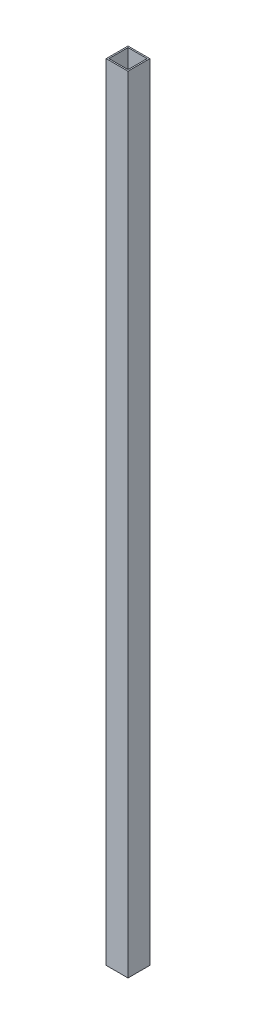
from build123d import *

# Parameters (mm, degrees)
SKETCH1_W           = 25.4
SKETCH1_H           = 25.4
SKETCH1_W_2         = 22.225
SKETCH1_H_2         = 22.225
BOSS_EXTRUDE1_DEPTH = 914.4


with BuildPart() as part:
    # Sketch1 → Boss-Extrude1 (new body)
    with BuildSketch(Plane(origin=(0, 0, 0), x_dir=(1, 0, 0), z_dir=(0, 1, 0))):
        with Locations((12.7, 12.7)):
            Rectangle(SKETCH1_W, SKETCH1_H)
        with Locations((12.7, 12.7)):
            Rectangle(SKETCH1_W_2, SKETCH1_H_2, mode=Mode.SUBTRACT)
    extrude(amount=BOSS_EXTRUDE1_DEPTH)


solid = part.part
